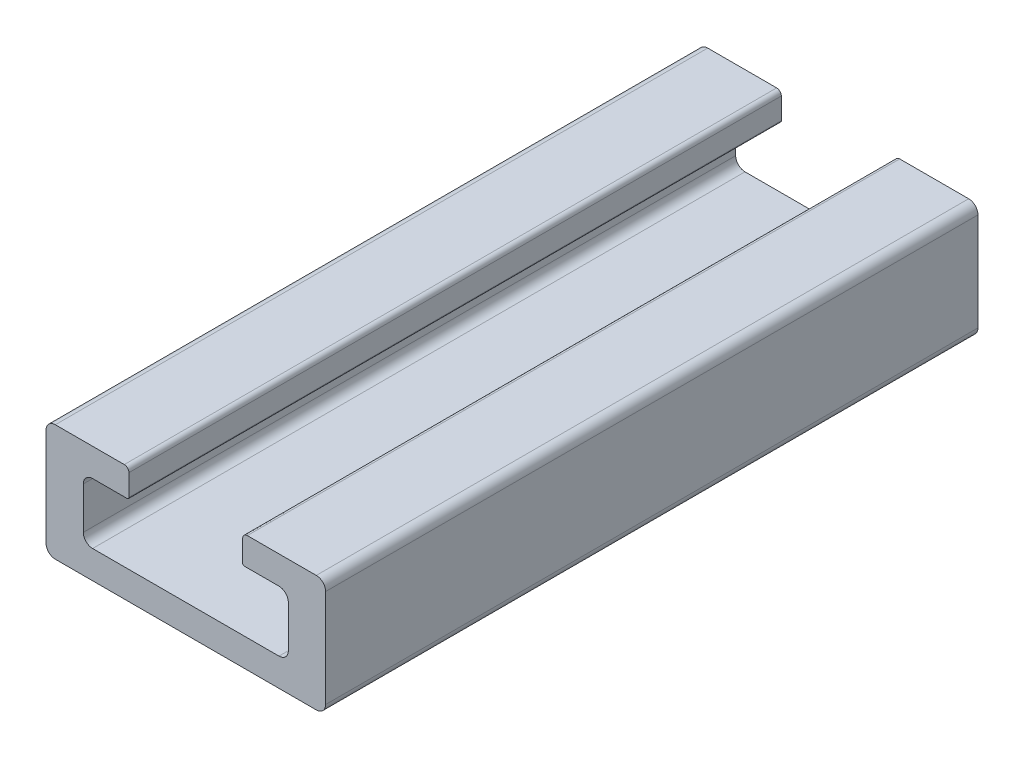
from build123d import *

# Parameters (mm, degrees)
BOSS_EXTRUDE1_DEPTH      = 35
BOSS_EXTRUDE1_DEPTH_BACK = 35


with BuildPart() as part:
    # Sketch1 → Boss-Extrude1 (new, two sides: drawn at the far end of the back side and taken through both)
    with BuildSketch(Plane.XY.offset(-BOSS_EXTRUDE1_DEPTH_BACK)):
        with BuildLine():
            Line((-15, 5.25), (-15, -5.25))
            ThreePointArc((-15, -5.25), (-14.707106781, -5.957106781), (-14, -6.25))
            Line((-14, -6.25), (14, -6.25))
            ThreePointArc((14, -6.25), (14.707106781, -5.957106781), (15, -5.25))
            Line((15, -5.25), (15, 5.25))
            ThreePointArc((15, 5.25), (14.707106781, 5.957106781), (14, 6.25))
            Line((14, 6.25), (6.6, 6.25))
            ThreePointArc((6.6, 6.25), (6.246446609, 6.103553391), (6.1, 5.75))
            Line((6.1, 5.75), (6.1, 3.45))
            ThreePointArc((6.1, 3.45), (6.158578644, 3.308578644), (6.3, 3.25))
            Line((6.3, 3.25), (10, 3.25))
            ThreePointArc((10, 3.25), (10.707106781, 2.957106781), (11, 2.25))
            Line((11, 2.25), (11, -2.25))
            ThreePointArc((11, -2.25), (10.707106781, -2.957106781), (10, -3.25))
            Line((10, -3.25), (-10, -3.25))
            ThreePointArc((-10, -3.25), (-10.707106781, -2.957106781), (-11, -2.25))
            Line((-11, -2.25), (-11, 2.25))
            ThreePointArc((-11, 2.25), (-10.707106781, 2.957106781), (-10, 3.25))
            Line((-10, 3.25), (-6.3, 3.25))
            ThreePointArc((-6.3, 3.25), (-6.158578644, 3.308578644), (-6.1, 3.45))
            Line((-6.1, 3.45), (-6.1, 5.75))
            ThreePointArc((-6.1, 5.75), (-6.246446609, 6.103553391), (-6.6, 6.25))
            Line((-6.6, 6.25), (-14, 6.25))
            ThreePointArc((-14, 6.25), (-14.707106781, 5.957106781), (-15, 5.25))
        make_face()
    extrude(amount=BOSS_EXTRUDE1_DEPTH + BOSS_EXTRUDE1_DEPTH_BACK)

    # Sketch2 → Cut-Revolve1 (revolve, cut)
    with BuildSketch(Plane(origin=(0, 0, 0), x_dir=(0, 0, -1), z_dir=(1, 0, 0))):
        Polygon((-20, -3.25), (-17, -3.25), (-17, -5.25), (-18.25, -5.25), (-18.25, -6.25), (-20, -6.25), align=None)
    revolve(axis=Axis((0, -6.25, 20), (0, 1, 0)), mode=Mode.SUBTRACT)

    # Sketch3 → Cut-Revolve2 (revolve, cut)
    with BuildSketch(Plane(origin=(0, 0, 0), x_dir=(0, 0, -1), z_dir=(1, 0, 0))):
        Polygon((20, -3.25), (23, -3.25), (23, -5.25), (21.75, -5.25), (21.75, -6.25), (20, -6.25), align=None)
    revolve(axis=Axis((0, -6.25, -20), (0, 1, 0)), mode=Mode.SUBTRACT)


solid = part.part
